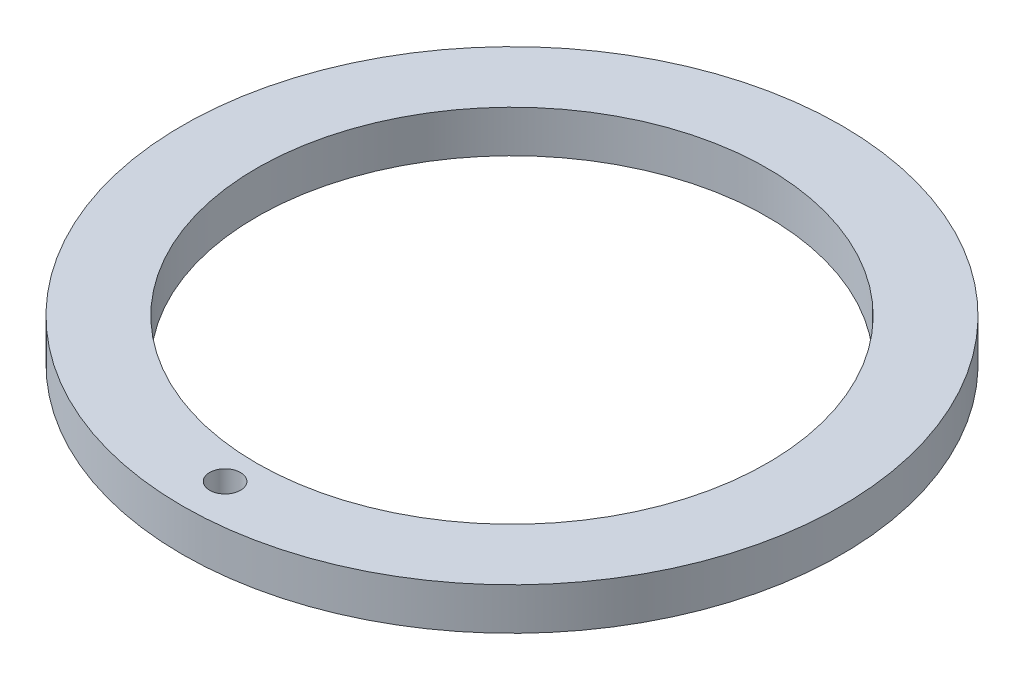
from build123d import *

# Parameters (mm, degrees)
SKETCH1_R           = 50.8
SKETCH1_R_2         = 39.37
BOSS_EXTRUDE2_DEPTH = 6.477
SKETCH2_R           = 2.38125
CUT_EXTRUDE1_DEPTH  = 73.133428651


with BuildPart() as part:
    # Sketch1 → Boss-Extrude2 (new body)
    with BuildSketch(Plane(origin=(0, 0, 0), x_dir=(1, 0, 0), z_dir=(0, 1, 0))):
        with Locations(Location((0, 0, 0), (0, 0, 270))):
            Circle(SKETCH1_R)
        with Locations(Location((0, 0, 0), (0, 0, 270))):
            Circle(SKETCH1_R_2, mode=Mode.SUBTRACT)
    extrude(amount=BOSS_EXTRUDE2_DEPTH)

    # Sketch2 → Cut-Extrude1 (cut, through all)
    with BuildSketch(Plane(origin=(0, 0, 0), x_dir=(1, 0, 0), z_dir=(0, 1, 0))):
        with Locations(Location((0, -44.22775, 0), (0, 0, 270))):
            Circle(SKETCH2_R)
    extrude(amount=CUT_EXTRUDE1_DEPTH, mode=Mode.SUBTRACT)


solid = part.part
